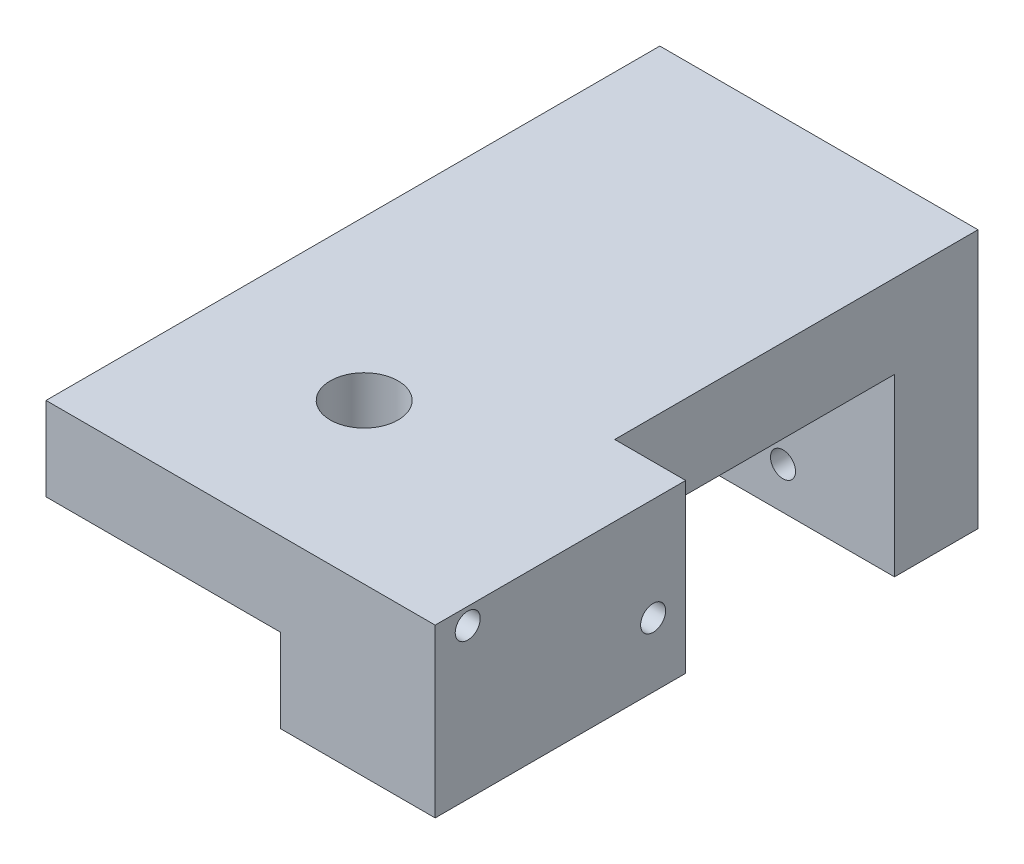
from build123d import *

# Parameters (mm, degrees)
SKETCH1_W                = 38.1
SKETCH1_H                = 63.5
SKETCH1_R                = 4.064
BOSS_EXTRUDE1_DEPTH      = 10
BOSS_EXTRUDE2_DEPTH      = 8.5
BOSS_EXTRUDE2_DEPTH_BACK = 10
BOSS_EXTRUDE2_START      = 38.1
SKETCH2_R                = 1.5
SKETCH3_R                = 1.5
BOSS_EXTRUDE3_DEPTH      = 10
SKETCH2_2_R              = 1.5
CUT_EXTRUDE1_DEPTH       = 10
CUT_EXTRUDE2_START       = 10
SKETCH3_2_R              = 1.5
CUT_EXTRUDE2_DEPTH       = 10


with BuildPart() as part:
    # Sketch1 → Boss-Extrude1 (new body)
    with BuildSketch(Plane(origin=(0, 0, 0), x_dir=(1, 0, 0), z_dir=(0, 1, 0))):
        with Locations((19.05, -31.75)):
            Rectangle(SKETCH1_W, SKETCH1_H)
        with Locations(Location((19.05, -44.45, 0), (0, 0, 270))):
            Circle(SKETCH1_R, mode=Mode.SUBTRACT)
    extrude(amount=BOSS_EXTRUDE1_DEPTH)

    # Sketch2 → Boss-Extrude2 (add, two sides: drawn at the far end of the back side and taken through both)
    with BuildSketch(Plane(origin=(0, 0, 0), x_dir=(0, 0, -1), z_dir=(1, 0, 0)).offset(BOSS_EXTRUDE2_START - BOSS_EXTRUDE2_DEPTH_BACK)):
        Polygon((-33.5, 0), (-33.5, -10), (-63.5, -10), (-63.5, 0), (-63.5, 10), (-33.5, 10), align=None)
        with Locations(Location((-59.6, 8, 0), (0, 0, 180))):
            Circle(SKETCH2_R, mode=Mode.SUBTRACT)
        with Locations(Location((-37.4, -2.3, 0), (0, 0, 180))):
            Circle(SKETCH2_R, mode=Mode.SUBTRACT)
    extrude(amount=BOSS_EXTRUDE2_DEPTH + BOSS_EXTRUDE2_DEPTH_BACK)

    # Sketch3 → Boss-Extrude3 (add)
    with BuildSketch(Plane.XY):
        Polygon((13.25, -21), (13.25, -3), (16.25, -3), (16.25, -21), (38.1, -21), (38.1, 10), (0, 10), (0, -21), align=None)
        with Locations((4.75, -16)):
            Circle(SKETCH3_R, mode=Mode.SUBTRACT)
        with Locations((24.75, -16)):
            Circle(SKETCH3_R, mode=Mode.SUBTRACT)
        with Locations((4.75, 4)):
            Circle(SKETCH3_R, mode=Mode.SUBTRACT)
        with Locations((24.75, 4)):
            Circle(SKETCH3_R, mode=Mode.SUBTRACT)
    extrude(amount=-BOSS_EXTRUDE3_DEPTH)

    # Sketch2<2> → Cut-Extrude1 (cut)
    with BuildSketch(Plane(origin=(0, 0, 0), x_dir=(0, 0, -1), z_dir=(1, 0, 0))):
        with Locations(Location((-59.6, 8, 0), (0, 0, 180))):
            Circle(SKETCH2_2_R)
    extrude(amount=CUT_EXTRUDE1_DEPTH, mode=Mode.SUBTRACT)

    # Sketch3<2> → Cut-Extrude2 (cut)
    with BuildSketch(Plane.XY.offset(CUT_EXTRUDE2_START)):
        with Locations((24.75, 4)):
            Circle(SKETCH3_2_R)
        with Locations((4.75, 4)):
            Circle(SKETCH3_2_R)
    extrude(amount=-CUT_EXTRUDE2_DEPTH, mode=Mode.SUBTRACT)


solid = part.part
